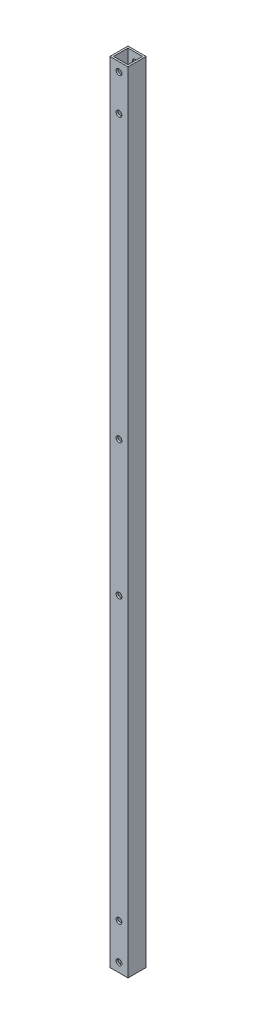
from build123d import *

# Parameters (mm, degrees)
SKETCH_1_W          = 10
SKETCH_1_H          = 10
SKETCH_1_W_2        = 8
SKETCH_1_H_2        = 8
EXTRUDE_1_DEPTH     = 218.715
SKETCH_2_R          = 1.6
CUT_EXTRUDE_1_DEPTH = 213.715
SKETCH_3_R          = 1.6
CUT_EXTRUDE_2_DEPTH = 10


with BuildPart() as part:
    # ｽｹｯﾁ1 → ﾎﾞｽ - 押し出し1 (new, symmetric)
    with BuildSketch(Plane(origin=(0, 0, 0), x_dir=(1, 0, 0), z_dir=(0, 1, 0))):
        Rectangle(SKETCH_1_W, SKETCH_1_H)
        Rectangle(SKETCH_1_W_2, SKETCH_1_H_2, mode=Mode.SUBTRACT)
    extrude(amount=EXTRUDE_1_DEPTH, both=True)

    # ｽｹｯﾁ2 → ｶｯﾄ - 押し出し1 (cut, symmetric)
    with BuildSketch(Plane.XY.offset(5)):
        with Locations((0, 213.715)):
            Circle(SKETCH_2_R)
        with Locations((0, 193.715)):
            Circle(SKETCH_2_R)
    cut_extrude_1 = extrude(amount=CUT_EXTRUDE_1_DEPTH, both=True, mode=Mode.SUBTRACT)

    # ﾐﾗｰ1: ｶｯﾄ - 押し出し1 across plane
    add(cut_extrude_1.mirror(Plane.ZX), mode=Mode.SUBTRACT)

    # ｽｹｯﾁ3 → ｶｯﾄ - 押し出し2 (cut)
    with BuildSketch(Plane.XY.offset(5)):
        with Locations((0.004997943, -37.579217745)):
            Circle(SKETCH_3_R)
        with Locations((-1.455e-06, 37.420782255)):
            Circle(SKETCH_3_R)
    extrude(amount=-CUT_EXTRUDE_2_DEPTH, mode=Mode.SUBTRACT)


solid = part.part
